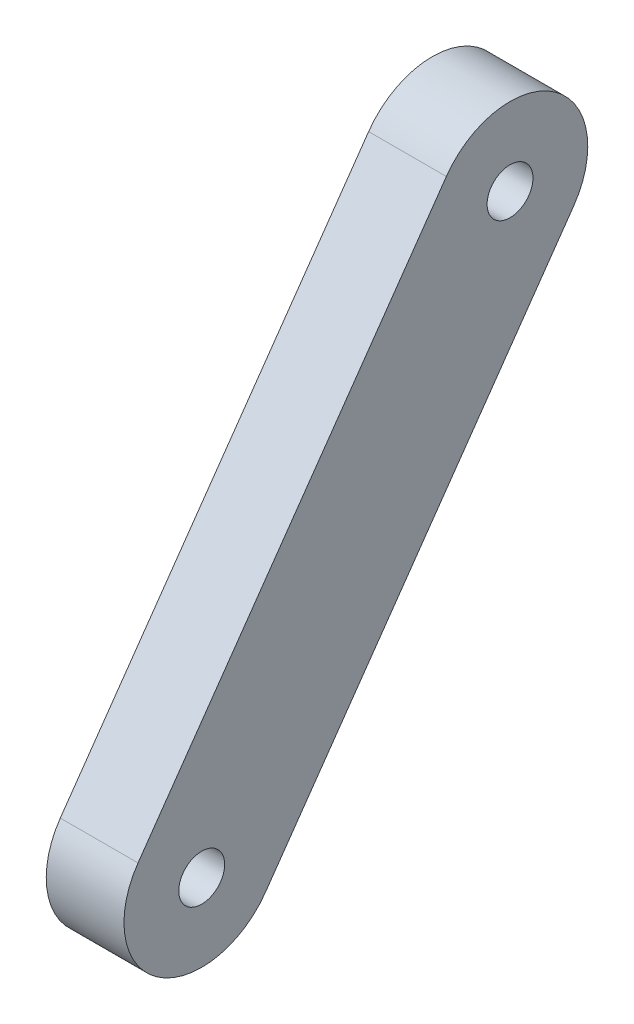
from build123d import *

# Parameters (mm, degrees)
SKETCH1_R           = 1.5
BOSS_EXTRUDE1_DEPTH = 2.54


with BuildPart() as part:
    # Sketch1 → Boss-Extrude1 (new, symmetric)
    with BuildSketch(Plane(origin=(0, 0, 0), x_dir=(0, 0, -1), z_dir=(1, 0, 0))):
        with BuildLine():
            Line((-4.161292385, 63.039730595), (15.986505719, 91.813768297))
            ThreePointArc((15.986505719, 91.813768297), (23.0615664, 93.061292385), (24.309090489, 85.986231703))
            Line((24.309090489, 85.986231703), (4.161292385, 57.212194001))
            ThreePointArc((4.161292385, 57.212194001), (-2.913768297, 55.964669913), (-4.161292385, 63.039730595))
        make_face()
        with Locations((20.147798104, 88.9)):
            Circle(SKETCH1_R, mode=Mode.SUBTRACT)
        with Locations((0, 60.125962298)):
            Circle(SKETCH1_R, mode=Mode.SUBTRACT)
    extrude(amount=BOSS_EXTRUDE1_DEPTH, both=True)


solid = part.part
